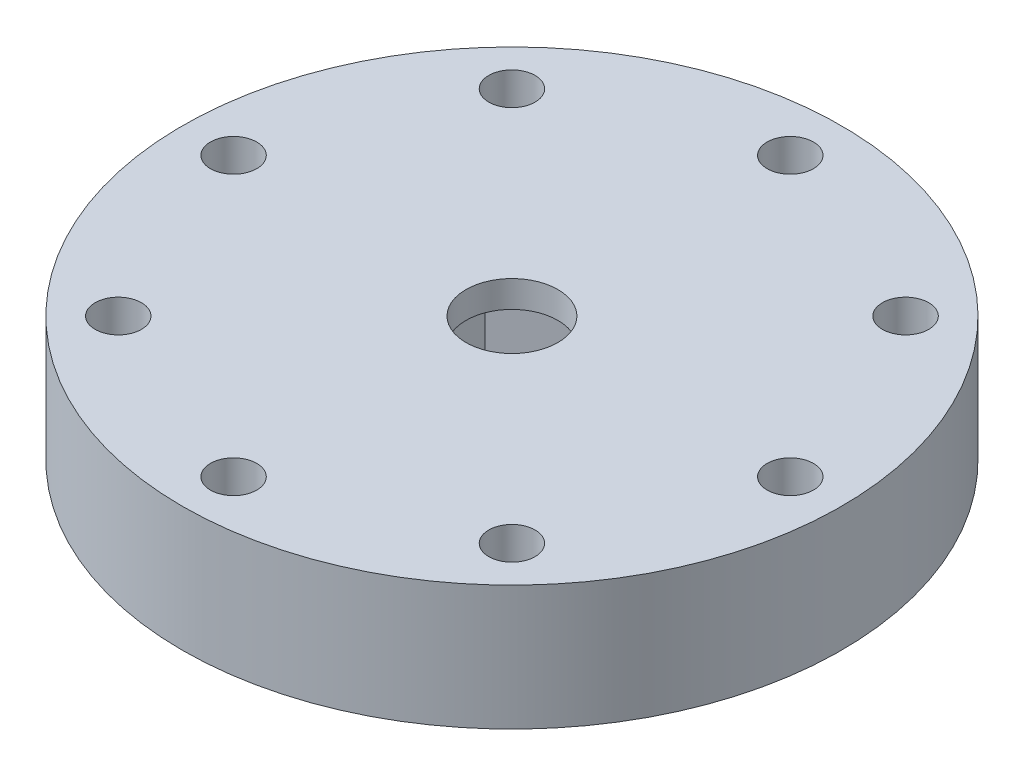
from build123d import *

# Parameters (mm, degrees)
SKETCH1_R               = 37
SKETCH1_R_2             = 1
BOSS_EXTRUDE1_DEPTH     = 14
F_3_8_CLEARANCE_HOLE1_D = 10.31748
SKETCH8_R               = 34.1
SKETCH8_R_2             = 28.4
CUT_EXTRUDE3_DEPTH      = 3
SKETCH9_R               = 22.5
CUT_EXTRUDE4_DEPTH      = 5
CUT_EXTRUDE2_DEPTH      = 6
CHAMFER1_SIZE           = 0.8
CIRPATTERN1_COUNT       = 8


with BuildPart() as part:
    # Sketch1 → Boss-Extrude1 (new body)
    with BuildSketch(Plane(origin=(0, 0, 0), x_dir=(1, 0, 0), z_dir=(0, 1, 0))):
        with Locations(Location((0, 0, 0), (0, 0, 270))):
            Circle(SKETCH1_R)
        with Locations(Location((0, 31.25, 0), (0, 0, 270))):
            Circle(SKETCH1_R_2, mode=Mode.SUBTRACT)
        with Locations(Location((22.097086912, 22.097086912, 0), (0, 0, 270))):
            Circle(SKETCH1_R_2, mode=Mode.SUBTRACT)
        with Locations(Location((31.25, 0, 0), (0, 0, 270))):
            Circle(SKETCH1_R_2, mode=Mode.SUBTRACT)
        with Locations(Location((22.097086912, -22.097086912, 0), (0, 0, 270))):
            Circle(SKETCH1_R_2, mode=Mode.SUBTRACT)
        with Locations(Location((0, -31.25, 0), (0, 0, 270))):
            Circle(SKETCH1_R_2, mode=Mode.SUBTRACT)
        with Locations(Location((-22.097086912, -22.097086912, 0), (0, 0, 270))):
            Circle(SKETCH1_R_2, mode=Mode.SUBTRACT)
        with Locations(Location((-31.25, 0, 0), (0, 0, 270))):
            Circle(SKETCH1_R_2, mode=Mode.SUBTRACT)
        with Locations(Location((-22.097086912, 22.097086912, 0), (0, 0, 270))):
            Circle(SKETCH1_R_2, mode=Mode.SUBTRACT)
    extrude(amount=BOSS_EXTRUDE1_DEPTH)

    # 3/8 Clearance Hole1 (through all)
    with Locations(Plane(origin=(0, 0, 0), x_dir=(-1, 0, 0), z_dir=(0, -1, 0))):
        with Locations((0, 0)):
            Hole(F_3_8_CLEARANCE_HOLE1_D / 2)

    # Sketch8 → Cut-Extrude3 (cut)
    with BuildSketch(Plane.XZ):
        with Locations(Location((0, 0, 0), (0, 0, 270))):
            Circle(SKETCH8_R)
        with Locations(Location((0, 0, 0), (0, 0, 270))):
            Circle(SKETCH8_R_2, mode=Mode.SUBTRACT)
    extrude(amount=-CUT_EXTRUDE3_DEPTH, mode=Mode.SUBTRACT)

    # Sketch9 → Cut-Extrude4 (cut)
    with BuildSketch(Plane.XZ):
        with Locations(Location((0, 0, 0), (0, 0, 270))):
            Circle(SKETCH9_R)
    extrude(amount=-CUT_EXTRUDE4_DEPTH, mode=Mode.SUBTRACT)

    # Sketch7 → Cut-Extrude2 (cut)
    with BuildSketch(Plane.XZ.offset(-5)):
        Polygon((0, 8.248891971), (-7.14375, 4.124445986), (-7.14375, -4.124445986), (0, -8.248891971), (7.14375, -4.124445986), (7.14375, 4.124445986), align=None)
    extrude(amount=-CUT_EXTRUDE2_DEPTH, mode=Mode.SUBTRACT)

    # Chamfer1
    chamfer1_edges = [part.edges().sort_by_distance(p)[0] for p in [
        (0, 0, 34.1),
        (0, 0, 28.4),
    ]]
    chamfer(chamfer1_edges, length=CHAMFER1_SIZE)

    # Sketch10 → Cut-Revolve1 (revolve, cut)
    with BuildSketch(Plane(origin=(0, 0, 0), x_dir=(0, 0, -1), z_dir=(1, 0, 0))):
        Polygon((32.95, 4.6), (32.95, 3), (31.25, 3), (31.25, 14), (33.85, 14), (33.85, 4.6), align=None)
    cut_revolve1 = revolve(axis=Axis((0, 14, -31.25), (0, 1, 0)), mode=Mode.SUBTRACT)

    # CirPattern1: Cut-Revolve1 ×8 about axis
    cirpattern1_axis = Axis((0, 0, 0), (0, 1, 0))
    for i in range(1, CIRPATTERN1_COUNT):
        add(cut_revolve1.rotate(cirpattern1_axis, i * 360 / CIRPATTERN1_COUNT), mode=Mode.SUBTRACT)


solid = part.part
